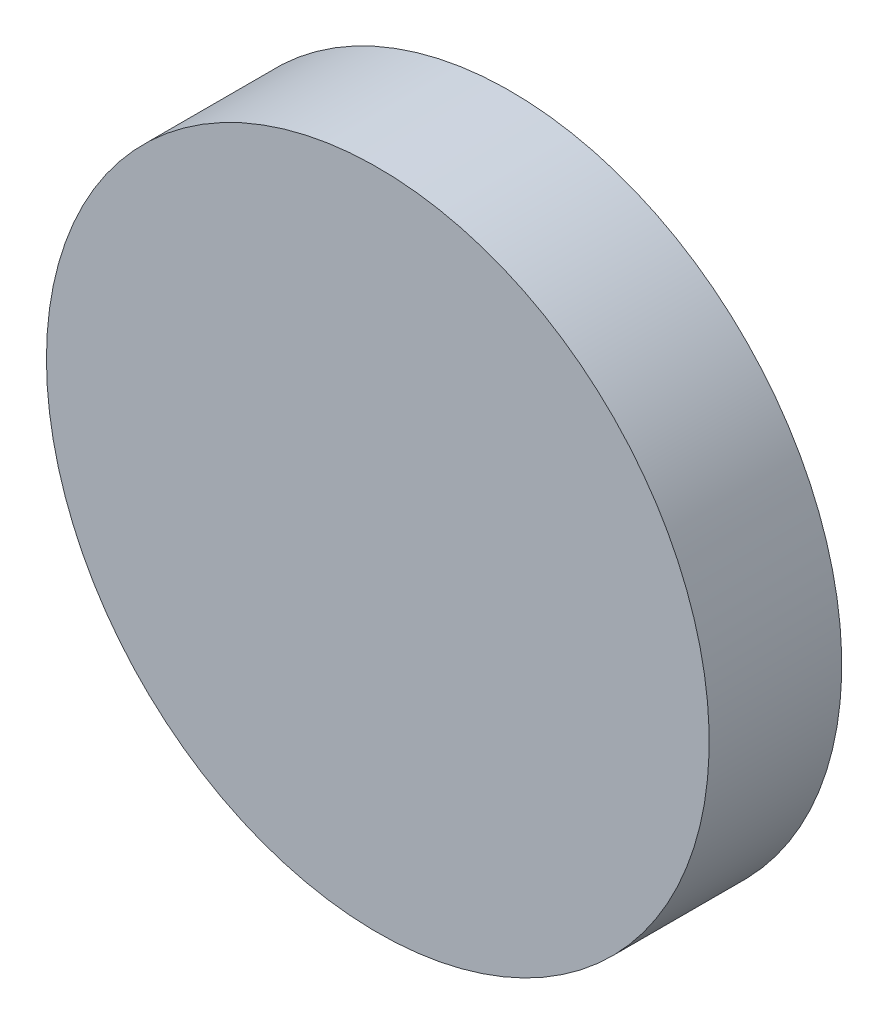
from build123d import *


with BuildPart() as part:
    # Sketch1 → Revolve1 (revolve)
    with BuildSketch(Plane(origin=(0, 0, 0), x_dir=(1, 0, 0), z_dir=(0, 1, 0))):
        Polygon((-50, -20), (0, -20), (0, -10), (-40, -10), (-40, 0), (-50, 0), align=None)
    revolve(axis=Axis((0, 0, 0), (0, 0, 1)))


solid = part.part
